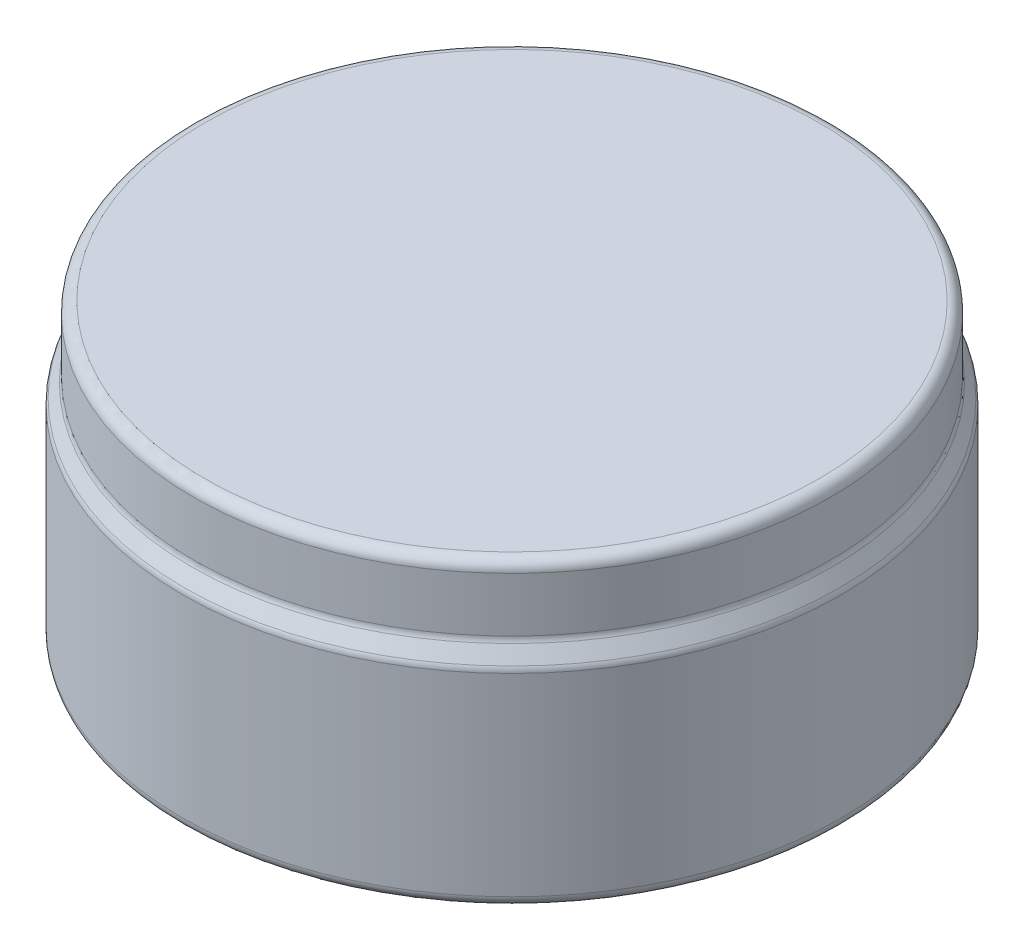
from build123d import *

# Parameters (mm, degrees)
FILLET1_R = 0.2
FILLET2_R = 0.2


with BuildPart() as part:
    # Sketch1 → Revolve1 (revolve)
    with BuildSketch(Plane.XY):
        with BuildLine():
            Line((0, 0), (-6.05, 0))
            Line((-6.05, 0), (-6.05, 3.803589838))
            Line((-6.05, 3.803589838), (-5.85, 4.15))
            Line((-5.85, 4.15), (-5.85, 5.2))
            ThreePointArc((-5.85, 5.2), (-5.791421356, 5.341421356), (-5.65, 5.4))
            Line((-5.65, 5.4), (0, 5.4))
            Line((0, 5.4), (0, 0))
        make_face()
    revolve(axis=Axis((0, 5.4, 0), (0, -1, 0)))

    # Fillet1
    fillet1_edges = [part.edges().sort_by_distance(p)[0] for p in [
        (6.05, 0, 0),
    ]]
    fillet(fillet1_edges, radius=FILLET1_R)

    # Fillet2
    fillet2_edges = [part.edges().sort_by_distance(p)[0] for p in [
        (5.85, 4.15, 0),
        (6.05, 3.803589838, 0),
    ]]
    fillet(fillet2_edges, radius=FILLET2_R)


solid = part.part
